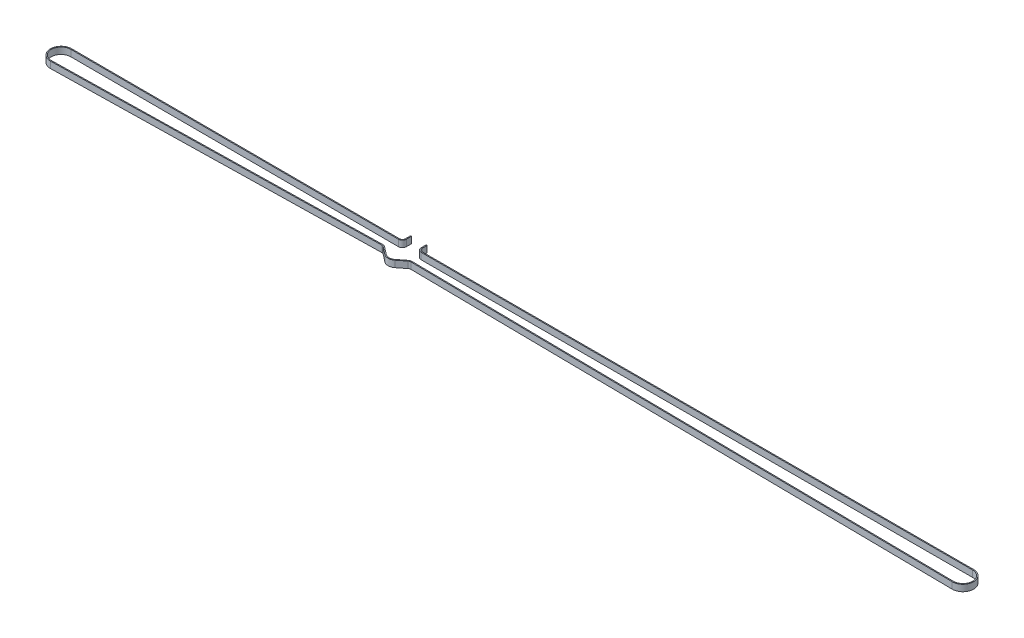
from build123d import *

# Parameters (mm, degrees)
EXTRUDE_THIN1_DEPTH = 5


with BuildPart() as part:
    # Sketch1 → Extrude-Thin1 (new, symmetric)
    with BuildSketch(Plane(origin=(0, 0, 0), x_dir=(1, 0, 0), z_dir=(0, 1, 0))):
        with BuildLine():
            Line((-183.400000811, 28), (-183.400000811, 20))
            ThreePointArc((-183.400000811, 20), (-185.161544932, 15.753173798), (-189.411833406, 14))
            Line((-189.411833406, 14), (-696.970447681, 14.999970889))
            ThreePointArc((-696.970447681, 14.999970889), (-711.999422352, -0.131640078), (-696.707182726, -14.997141662))
            Line((-696.707182726, -14.997141662), (-194.526888217, -5.192135604))
            ThreePointArc((-194.526888217, -5.192135604), (-192.341242187, -5.52554921), (-190.393789073, -6.572277241))
            Line((-190.393789073, -6.572277241), (-178.779742807, -15.662291703))
            ThreePointArc((-178.779742807, -15.662291703), (-172, -18.000012126), (-165.220257193, -15.662291703))
            Line((-165.220257193, -15.662291703), (-153.606210927, -6.572277241))
            ThreePointArc((-153.606210927, -6.572277241), (-151.683201757, -5.533765565), (-149.524681207, -5.191333376))
            Line((-149.524681207, -5.191333376), (696.826189088, -14.998992958))
            ThreePointArc((696.826189088, -14.998992958), (711.999796679, -0.078099937), (696.982385781, 14.999989658))
            Line((696.982385781, 14.999989658), (-154.59294936, 14))
            ThreePointArc((-154.59294936, 14), (-158.840146905, 15.75486609), (-160.599999189, 20))
            Line((-160.599999189, 20), (-160.599999189, 28))
            Line((-160.599999189, 28), (-159.099999189, 28))
            Line((-159.099999189, 28), (-159.099999189, 20))
            ThreePointArc((-159.099999189, 20), (-157.780109672, 16.816148836), (-154.594710782, 15.499998966))
            Line((-154.594710782, 15.499998966), (696.980624359, 16.499988624))
            ThreePointArc((696.980624359, 16.499988624), (713.499776346, -0.08590993), (696.808807996, -16.498892254))
            Line((696.808807996, -16.498892254), (-149.542062298, -6.691232672))
            ThreePointArc((-149.542062298, -6.691232672), (-151.202462721, -6.954642048), (-152.681700545, -7.753497183))
            Line((-152.681700545, -7.753497183), (-164.29574681, -16.843511645))
            ThreePointArc((-164.29574681, -16.843511645), (-172, -19.500012126), (-179.70425319, -16.843511645))
            Line((-179.70425319, -16.843511645), (-191.318299455, -7.753497183))
            ThreePointArc((-191.318299455, -7.753497183), (-192.816340312, -6.948321775), (-194.497606489, -6.69184977))
            Line((-194.497606489, -6.69184977), (-696.677900999, -16.496855829))
            ThreePointArc((-696.677900999, -16.496855829), (-713.499364587, -0.144804086), (-696.967492449, 16.499967978))
            Line((-696.967492449, 16.499967978), (-189.408878174, 15.499997089))
            ThreePointArc((-189.408878174, 15.499997089), (-186.221159756, 16.814878288), (-184.900000811, 20))
            Line((-184.900000811, 20), (-184.900000811, 28))
            Line((-184.900000811, 28), (-183.400000811, 28))
        make_face()
    extrude(amount=EXTRUDE_THIN1_DEPTH, both=True)


solid = part.part
